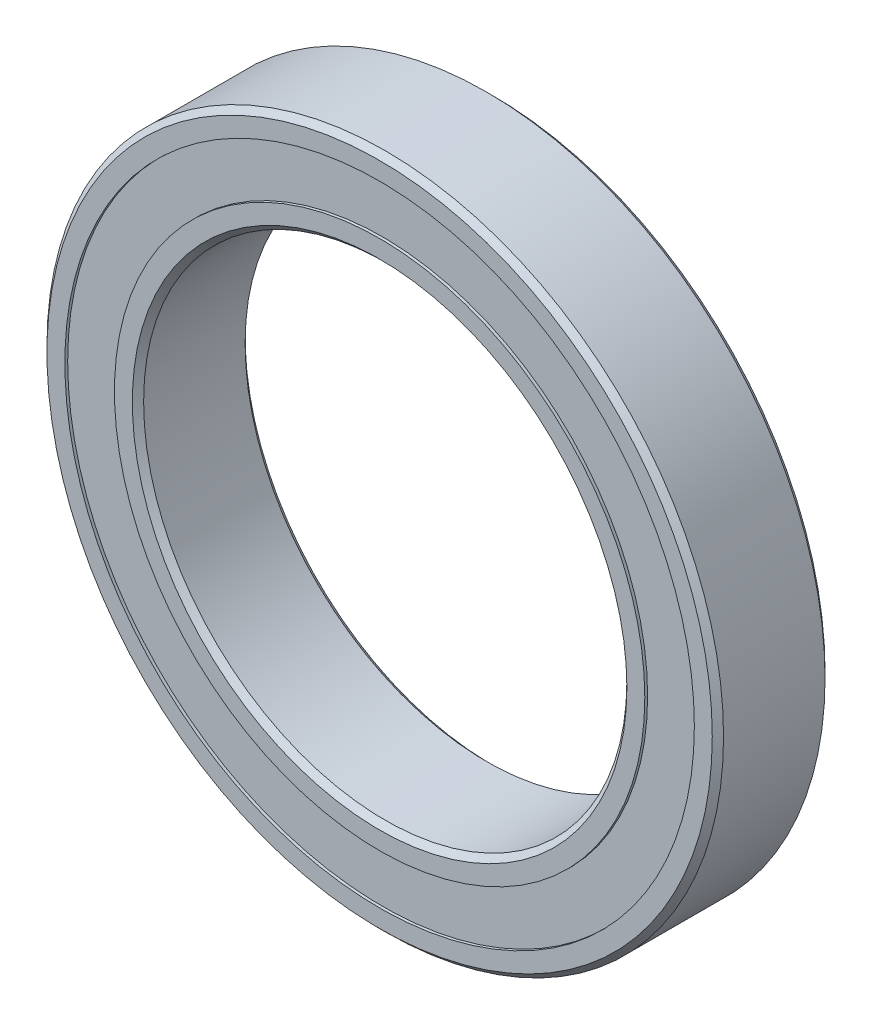
from build123d import *

# Parameters (mm, degrees)
CIRPATTERN1_COUNT = 12


with BuildPart() as part:
    # Sketch6 → Revolve1 (revolve)
    with BuildSketch(Plane(origin=(0, 0, 0), x_dir=(0, 0, -1), z_dir=(1, 0, 0))):
        with BuildLine():
            Line((-3.4999999999999996, 20.65000000000001), (-3.4999999999999996, 19.538211538461553))
            Line((-3.4999999999999996, 19.538211538461553), (-1.5555555555555556, 19.538211538461546))
            ThreePointArc((-1.5555555555555556, 19.538211538461546), (1.3e-16, 20.187583858350592), (1.5555555555555556, 19.538211538461546))
            Line((1.5555555555555556, 19.538211538461546), (3.4999999999999996, 19.538211538461553))
            Line((3.4999999999999996, 19.538211538461553), (3.4999999999999996, 20.650000000000002))
            Line((3.4999999999999996, 20.650000000000002), (3.1499999999999972, 21.000000000000004))
            Line((3.1499999999999972, 21.000000000000004), (-3.1499999999999972, 21.000000000000004))
            Line((-3.1499999999999972, 21.000000000000004), (-3.4999999999999996, 20.65000000000001))
        make_face()
        with BuildLine():
            Line((-3.4999999999999996, 15.349500000000013), (-3.4999999999999996, 16.461288461538466))
            Line((-3.4999999999999996, 16.461288461538466), (-1.5555555555555556, 16.461288461538473))
            ThreePointArc((-1.5555555555555556, 16.461288461538473), (1.3e-16, 15.811916141649428), (1.5555555555555556, 16.461288461538473))
            Line((1.5555555555555556, 16.461288461538473), (3.4999999999999996, 16.461288461538466))
            Line((3.4999999999999996, 16.461288461538466), (3.4999999999999996, 15.349500000000013))
            Line((3.4999999999999996, 15.349500000000013), (3.149999999999999, 14.99950000000001))
            Line((3.149999999999999, 14.99950000000001), (-3.149999999999999, 14.999500000000006))
            Line((-3.149999999999999, 14.999500000000006), (-3.4999999999999996, 15.349500000000013))
        make_face()
    revolve(axis=Axis((0, 0, 3.4999999999999996), (0, 0, -1)))



with BuildPart() as body_2:
    # Sketch4 → Revolve2 (revolve)
    with BuildSketch(Plane(origin=(0, 0, 0), x_dir=(0, 0, -1), z_dir=(1, 0, 0))):
        with BuildLine():
            Line((-2.1878338583505816, 17.99975000000001), (2.1878338583505816, 17.99975000000001))
            ThreePointArc((2.1878338583505816, 17.99975000000001), (1.3e-16, 20.187583858350592), (-2.1878338583505816, 17.99975000000001))
        make_face()
    revolve(axis=Axis((0, 17.99975000000001, 2.1878338583505816), (0, 0, -1)))


with BuildPart() as cirpattern1_1:
    # CirPattern1: pattern copy
    add(body_2.part.rotate(Axis((0, 0, -3.4999999999999996), (0, 0, 1)), 1 * 360 / CIRPATTERN1_COUNT))


with BuildPart() as cirpattern1_2:
    # CirPattern1: pattern copy
    add(body_2.part.rotate(Axis((0, 0, -3.4999999999999996), (0, 0, 1)), 2 * 360 / CIRPATTERN1_COUNT))


with BuildPart() as cirpattern1_3:
    # CirPattern1: pattern copy
    add(body_2.part.rotate(Axis((0, 0, -3.4999999999999996), (0, 0, 1)), 3 * 360 / CIRPATTERN1_COUNT))


with BuildPart() as cirpattern1_4:
    # CirPattern1: pattern copy
    add(body_2.part.rotate(Axis((0, 0, -3.4999999999999996), (0, 0, 1)), 4 * 360 / CIRPATTERN1_COUNT))


with BuildPart() as cirpattern1_5:
    # CirPattern1: pattern copy
    add(body_2.part.rotate(Axis((0, 0, -3.4999999999999996), (0, 0, 1)), 5 * 360 / CIRPATTERN1_COUNT))


with BuildPart() as cirpattern1_6:
    # CirPattern1: pattern copy
    add(body_2.part.rotate(Axis((0, 0, -3.4999999999999996), (0, 0, 1)), 6 * 360 / CIRPATTERN1_COUNT))


with BuildPart() as cirpattern1_7:
    # CirPattern1: pattern copy
    add(body_2.part.rotate(Axis((0, 0, -3.4999999999999996), (0, 0, 1)), 7 * 360 / CIRPATTERN1_COUNT))


with BuildPart() as cirpattern1_8:
    # CirPattern1: pattern copy
    add(body_2.part.rotate(Axis((0, 0, -3.4999999999999996), (0, 0, 1)), 8 * 360 / CIRPATTERN1_COUNT))


with BuildPart() as cirpattern1_9:
    # CirPattern1: pattern copy
    add(body_2.part.rotate(Axis((0, 0, -3.4999999999999996), (0, 0, 1)), 9 * 360 / CIRPATTERN1_COUNT))


with BuildPart() as cirpattern1_10:
    # CirPattern1: pattern copy
    add(body_2.part.rotate(Axis((0, 0, -3.4999999999999996), (0, 0, 1)), 10 * 360 / CIRPATTERN1_COUNT))


with BuildPart() as cirpattern1_11:
    # CirPattern1: pattern copy
    add(body_2.part.rotate(Axis((0, 0, -3.4999999999999996), (0, 0, 1)), 11 * 360 / CIRPATTERN1_COUNT))


with BuildPart() as part_1:
    add(part.part)

    add(body_2.part)  # Revolve3 merges body 2

    add(cirpattern1_1.part)  # Revolve3 merges CirPattern1_1

    add(cirpattern1_2.part)  # Revolve3 merges CirPattern1_2

    add(cirpattern1_3.part)  # Revolve3 merges CirPattern1_3

    add(cirpattern1_4.part)  # Revolve3 merges CirPattern1_4

    add(cirpattern1_5.part)  # Revolve3 merges CirPattern1_5

    add(cirpattern1_6.part)  # Revolve3 merges CirPattern1_6

    add(cirpattern1_7.part)  # Revolve3 merges CirPattern1_7

    add(cirpattern1_8.part)  # Revolve3 merges CirPattern1_8

    add(cirpattern1_9.part)  # Revolve3 merges CirPattern1_9

    add(cirpattern1_10.part)  # Revolve3 merges CirPattern1_10

    add(cirpattern1_11.part)  # Revolve3 merges CirPattern1_11
    # Sketch5 → Revolve3 (revolve)
    with BuildSketch(Plane(origin=(0, 0, 0), x_dir=(0, 0, -1), z_dir=(1, 0, 0))):
        Polygon((-3.324999999999993, 19.538211538461553), (-2.1878338583505816, 19.538211538461553), (-2.1878338583505808, 16.461288461538466), (-3.324999999999992, 16.461288461538466), align=None)
        Polygon((3.324999999999993, 19.538211538461553), (2.1878338583505816, 19.538211538461553), (2.1878338583505825, 16.461288461538466), (3.324999999999993, 16.461288461538466), align=None)
    revolve(axis=Axis((0, 0, 3.4999999999999996), (0, 0, -1)))


solid = part_1.part
